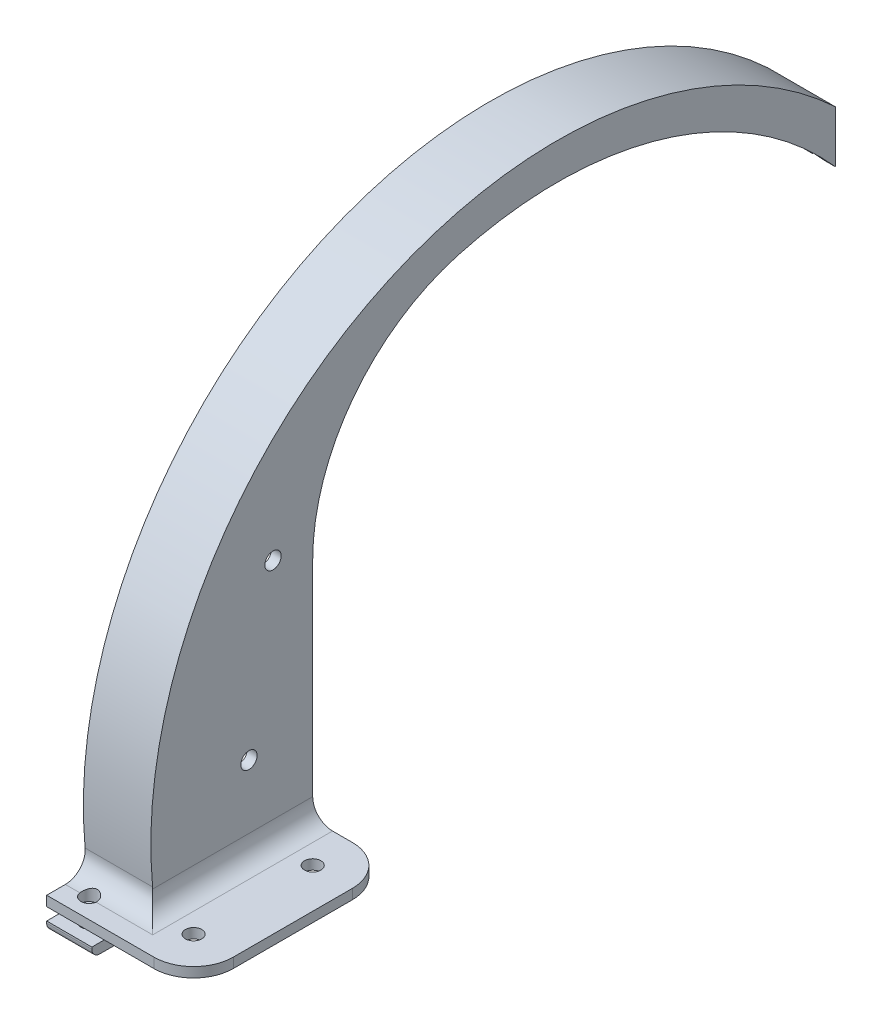
from build123d import *

# Parameters (mm, degrees)
SALIENTE_EXTRUIR1_DEPTH = 17
CORTAR_EXTRUIR1_DEPTH   = 8.88
CORTAR_EXTRUIR2_START   = -5.62
CROQUIS6_R              = 99.89
CROQUIS6_R_2            = 93.27
CORTAR_EXTRUIR2_DEPTH   = 3.12
SALIENTE_EXTRUIR3_DEPTH = 17
SALIENTE_EXTRUIR4_START = -5.62
SALIENTE_EXTRUIR4_DEPTH = 11.38
SALIENTE_EXTRUIR5_START = -2.5
SALIENTE_EXTRUIR5_DEPTH = 2.5
REDONDEO1_R             = 50
CROQUIS7_R              = 2.06
SALIENTE_EXTRUIR6_DEPTH = 2.5
REDONDEO7_R             = 5
CROQUIS8_R              = 2.06
CORTAR_EXTRUIR3_DEPTH   = 172.950113436
CROQUIS9_R              = 2.06
CORTAR_EXTRUIR4_DEPTH   = 154.134258449


with BuildPart() as part:
    # Croquis1 → Saliente-Extruir1 (new body)
    with BuildSketch(Plane(origin=(0, 0, 0), x_dir=(0, 0, -1), z_dir=(1, 0, 0))):
        with BuildLine():
            ThreePointArc((70, 74.724240378), (-48.602144929, 90.119607235), (-100.893798125, -17.44))
            Line((-100.893798125, -17.44), (-91.624992769, -17.44))
            ThreePointArc((-91.624992769, -17.44), (-40.990957413, 83.779677192), (70, 61.638404425))
            Line((70, 61.638404425), (70, 74.724240378))
        make_face()
    extrude(amount=SALIENTE_EXTRUIR1_DEPTH)

    # Croquis5 → Cortar-Extruir1 (cut)
    with BuildSketch(Plane.ZY):
        with BuildLine():
            Line((-70, 71.176041615), (-70, 65.359719247))
            ThreePointArc((-70, 65.359719247), (43.12748064, 85.509726427), (94.168674728, -17.44))
            Line((94.168674728, -17.44), (98.294838623, -17.44))
            ThreePointArc((98.294838623, -17.44), (46.5118284, 88.332772621), (-70, 71.176041615))
        make_face()
    extrude(amount=-CORTAR_EXTRUIR1_DEPTH, mode=Mode.SUBTRACT)

    # Croquis6 → Cortar-Extruir2 (cut)
    with BuildSketch(Plane(origin=(17, 0, 0), x_dir=(0, 0, -1), z_dir=(1, 0, 0)).offset(CORTAR_EXTRUIR2_START)):
        Circle(CROQUIS6_R)
        Circle(CROQUIS6_R_2, mode=Mode.SUBTRACT)
    extrude(amount=CORTAR_EXTRUIR2_DEPTH, mode=Mode.SUBTRACT)

    # Croquis2 → Saliente-Extruir3 (add, through all)
    with BuildSketch(Plane(origin=(17, 0, 0), x_dir=(0, 0, -1), z_dir=(1, 0, 0))):
        with BuildLine():
            Line((-111.624992769, -14.94), (-111.624992769, -17.44))
            Line((-111.624992769, -17.44), (-100.893798125, -17.44))
            ThreePointArc((-100.893798125, -17.44), (-101.101710796, -16.19123757), (-101.294168144, -14.94))
            Line((-101.294168144, -14.94), (-111.624992769, -14.94))
        make_face()
    extrude(amount=-SALIENTE_EXTRUIR3_DEPTH)

    # Croquis3 → Saliente-Extruir4 (add)
    with BuildSketch(Plane(origin=(17, 0, 0), x_dir=(0, 0, -1), z_dir=(1, 0, 0)).offset(SALIENTE_EXTRUIR4_START)):
        with BuildLine():
            Line((-91.624992769, -17.44), (-91.624992769, -21.06))
            ThreePointArc((-91.624992769, -21.06), (-92.210779207, -22.474213562), (-93.624992769, -23.06))
            Line((-93.624992769, -23.06), (-109.624992769, -23.06))
            ThreePointArc((-109.624992769, -23.06), (-111.039206332, -22.474213562), (-111.624992769, -21.06))
            Line((-111.624992769, -21.06), (-111.624992769, -20.56))
            Line((-111.624992769, -20.56), (-100.893798125, -20.56))
            Line((-100.893798125, -20.56), (-100.893798125, -17.44))
            Line((-100.893798125, -17.44), (-91.624992769, -17.44))
        make_face()
    extrude(amount=-SALIENTE_EXTRUIR4_DEPTH)

    # Croquis4 → Saliente-Extruir5 (add)
    with BuildSketch(Plane(origin=(17, 0, 0), x_dir=(0, 0, -1), z_dir=(1, 0, 0)).offset(SALIENTE_EXTRUIR5_START)):
        with BuildLine():
            Line((-61.624992769, 70.011807334), (-61.624992769, -17.44))
            Line((-61.624992769, -17.44), (-91.624992769, -17.44))
            ThreePointArc((-91.624992769, -17.44), (-88.223263193, 30.264644911), (-61.624992769, 70.011807334))
        make_face()
    extrude(amount=SALIENTE_EXTRUIR5_DEPTH)

    # Redondeo1
    redondeo1_edges = [part.edges().sort_by_distance(p)[0] for p in [
        (15.75, 70.011807334, 61.624992769),
    ]]
    fillet(redondeo1_edges, radius=REDONDEO1_R)

    # Croquis7 → Saliente-Extruir6 (add)
    with BuildSketch(Plane.XZ.offset(17.44)):
        with BuildLine():
            Line((17, 111.624992769), (27, 111.624992769))
            ThreePointArc((27, 111.624992769), (34.071067812, 108.696060581), (37, 101.624992769))
            Line((37, 101.624992769), (37, 71.624992769))
            ThreePointArc((37, 71.624992769), (34.071067812, 64.553924958), (27, 61.624992769))
            Line((27, 61.624992769), (17, 61.624992769))
            Line((17, 61.624992769), (17, 111.624992769))
        make_face()
        with Locations(Location((27, 101.624992769, 0), (0, 0, 270))):
            Circle(CROQUIS7_R, mode=Mode.SUBTRACT)
        with Locations(Location((27, 71.624992769, 0), (0, 0, 270))):
            Circle(CROQUIS7_R, mode=Mode.SUBTRACT)
    extrude(amount=-SALIENTE_EXTRUIR6_DEPTH)

    # Redondeo7
    redondeo7_edges = [part.edges().sort_by_distance(p)[0] for p in [
        (17, -14.94, 81.459580457),
        (8.5, -14.94, 101.294168144),
    ]]
    fillet(redondeo7_edges, radius=REDONDEO7_R)

    # Croquis8 → Cortar-Extruir3 (cut, through all)
    with BuildSketch(Plane.XZ.offset(23.06)):
        with Locations(Location((5.69, 106.624992769, 0), (0, 0, 171.513837035))):
            Circle(CROQUIS8_R)
    extrude(amount=-CORTAR_EXTRUIR3_DEPTH, mode=Mode.SUBTRACT)

    # Croquis9 → Cortar-Extruir4 (cut, through all)
    with BuildSketch(Plane.ZY.offset(-14.5)):
        with Locations((77.684992769, 6.06)):
            Circle(CROQUIS9_R)
        with Locations((71.624992769, 46.574468299)):
            Circle(CROQUIS9_R)
    extrude(amount=-CORTAR_EXTRUIR4_DEPTH, mode=Mode.SUBTRACT)


solid = part.part
